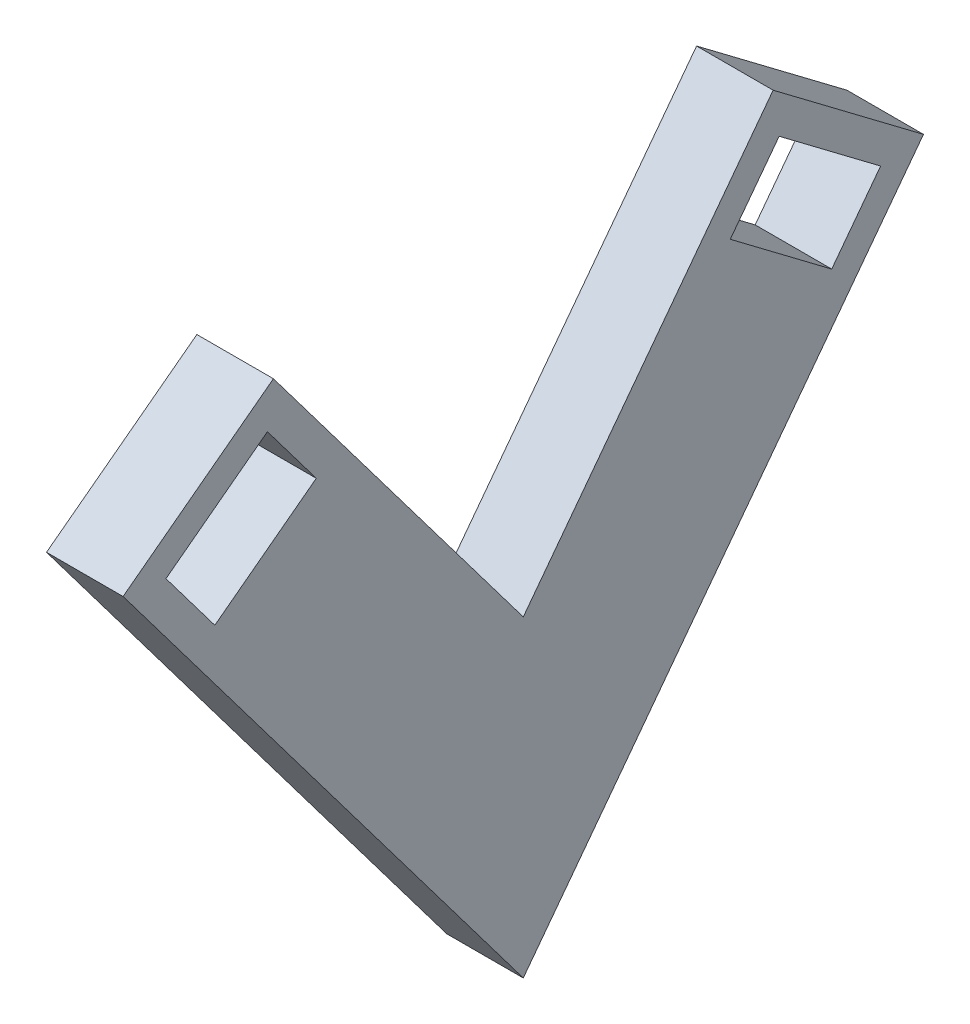
from build123d import *

# Parameters (mm, degrees)
EXTRUDE_1_DEPTH     = 5
CUT_EXTRUDE_1_DEPTH = 5


with BuildPart() as part:
    # 草图3 → 凸台-拉伸1 (new body)
    with BuildSketch(Plane(origin=(0, 0, 0), x_dir=(0, 0, -1), z_dir=(1, 0, 0))):
        Polygon((-14.574209951, 22.116049871), (1.744837218, 0.483518594), (1.744837218, -19.94046656), (-24.39354953, 14.708582677), align=None)
    extrude(amount=EXTRUDE_1_DEPTH)

    # 草图2 → 切除-拉伸1 (cut)
    with BuildSketch(Plane(origin=(0, 0, 0), x_dir=(0, 0, -1), z_dir=(1, 0, 0))):
        Polygon((-18.40060728, 10.085310763), (-11.774548865, 15.083845536), (-14.966384322, 19.314943078), (-21.592442737, 14.316408305), align=None)
    extrude(amount=CUT_EXTRUDE_1_DEPTH, mode=Mode.SUBTRACT)

    # 镜向1: part across plane


with BuildPart() as part_1:
    add(part.part)
    add(part.part.mirror(Plane(origin=(5, 0.483518594, -1.744837218), x_dir=(1, 0, 0), z_dir=(0, 0, 1))))


solid = part_1.part
